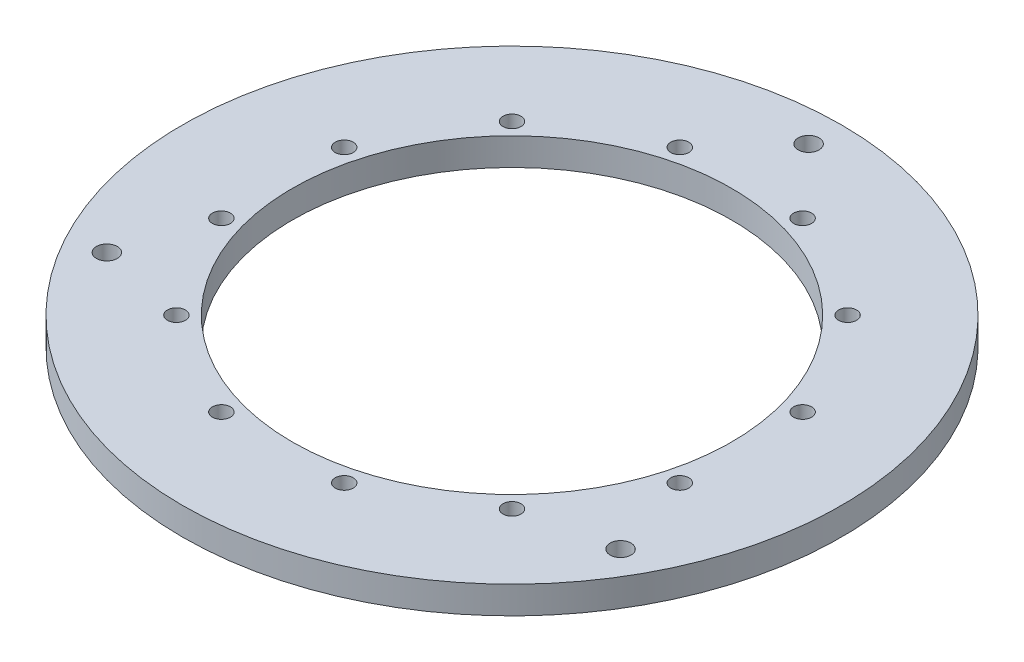
from build123d import *

# Parameters (mm, degrees)
SKETCH2_R           = 76.2
SKETCH2_R_2         = 2.0828
SKETCH2_R_3         = 2.413
SKETCH2_R_4         = 50.8
BOSS_EXTRUDE1_DEPTH = 6.35


with BuildPart() as part:
    # Sketch2 → Boss-Extrude1 (new body)
    with BuildSketch(Plane(origin=(0, 0, 0), x_dir=(1, 0, 0), z_dir=(0, 1, 0))):
        with Locations(Location((0, 0, 0), (0, 0, 270))):
            Circle(SKETCH2_R)
        with Locations(Location((-14.199848091, 52.994554534, 0), (0, 0, 270))):
            Circle(SKETCH2_R_2, mode=Mode.SUBTRACT)
        with Locations(Location((-38.794706443, 38.794706443, 0), (0, 0, 270))):
            Circle(SKETCH2_R_2, mode=Mode.SUBTRACT)
        with Locations(Location((-52.994554534, 14.199848091, 0), (0, 0, 270))):
            Circle(SKETCH2_R_2, mode=Mode.SUBTRACT)
        with Locations(Location((-52.994554534, -14.199848091, 0), (0, 0, 270))):
            Circle(SKETCH2_R_2, mode=Mode.SUBTRACT)
        with Locations(Location((-38.794706443, -38.794706443, 0), (0, 0, 270))):
            Circle(SKETCH2_R_2, mode=Mode.SUBTRACT)
        with Locations(Location((-14.199848091, -52.994554534, 0), (0, 0, 270))):
            Circle(SKETCH2_R_2, mode=Mode.SUBTRACT)
        with Locations(Location((14.199848091, -52.994554534, 0), (0, 0, 270))):
            Circle(SKETCH2_R_2, mode=Mode.SUBTRACT)
        with Locations(Location((38.794706443, -38.794706443, 0), (0, 0, 270))):
            Circle(SKETCH2_R_2, mode=Mode.SUBTRACT)
        with Locations(Location((52.994554534, -14.199848091, 0), (0, 0, 270))):
            Circle(SKETCH2_R_2, mode=Mode.SUBTRACT)
        with Locations(Location((52.994554534, 14.199848091, 0), (0, 0, 270))):
            Circle(SKETCH2_R_2, mode=Mode.SUBTRACT)
        with Locations(Location((38.794706443, 38.794706443, 0), (0, 0, 270))):
            Circle(SKETCH2_R_2, mode=Mode.SUBTRACT)
        with Locations(Location((14.199848091, 52.994554534, 0), (0, 0, 270))):
            Circle(SKETCH2_R_2, mode=Mode.SUBTRACT)
        with Locations(Location((-59.392022192, -34.29, 0), (0, 0, 270))):
            Circle(SKETCH2_R_3, mode=Mode.SUBTRACT)
        with Locations(Location((59.392022192, -34.29, 0), (0, 0, 270))):
            Circle(SKETCH2_R_3, mode=Mode.SUBTRACT)
        with Locations(Location((0, 68.58, 0), (0, 0, 270))):
            Circle(SKETCH2_R_3, mode=Mode.SUBTRACT)
        with Locations(Location((0, 0, 0), (0, 0, 270))):
            Circle(SKETCH2_R_4, mode=Mode.SUBTRACT)
    extrude(amount=BOSS_EXTRUDE1_DEPTH)


solid = part.part
